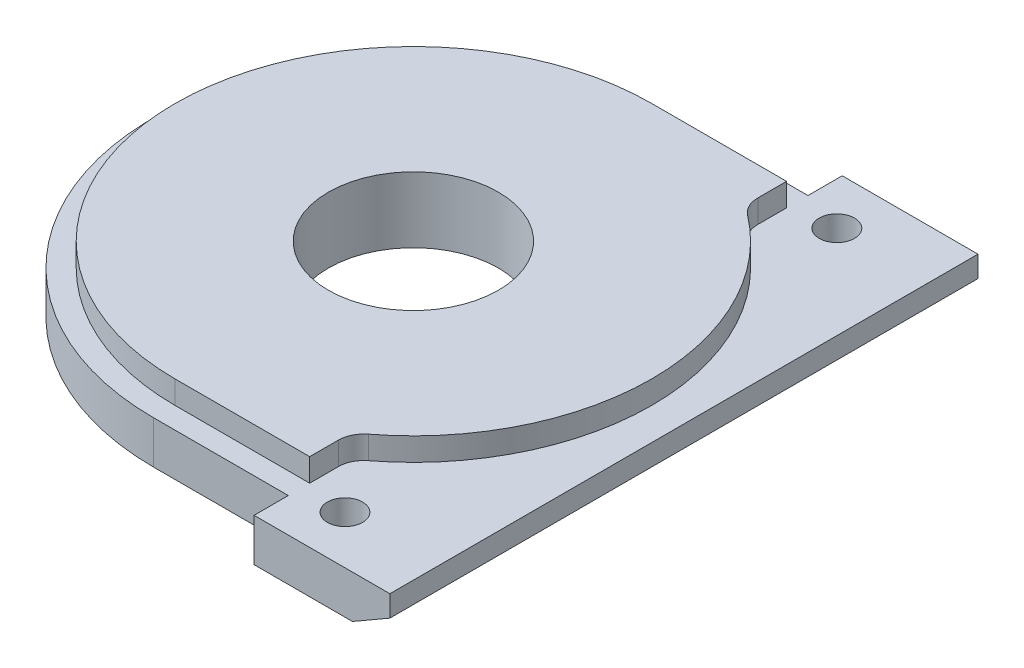
from build123d import *

# Parameters (mm, degrees)
BOSS_EXTRUDE1_DEPTH = 4
BOSS_EXTRUDE2_DEPTH = 2.25
SKETCH3_R           = 7.95
CUT_EXTRUDE1_DEPTH  = 9.25
SKETCH4_R           = 1.65
CUT_EXTRUDE2_DEPTH  = 9.25
CUT_EXTRUDE3_DEPTH  = 3
FILLET1_R           = 2.38125
CHAMFER1_SIZE       = 3.5
CHAMFER1_SIZE2      = 2.020725942
BOSS_EXTRUDE3_DEPTH = 4
SKETCH7_W           = 56.562445917
SKETCH7_H           = 51.963873078
CUT_EXTRUDE4_DEPTH  = 0.1
FILLET3_R           = 2.38


with BuildPart() as part:
    # Sketch1 → Boss-Extrude1 (new body)
    with BuildSketch(Plane(origin=(0, 0, 0), x_dir=(1, 0, 0), z_dir=(0, 1, 0))):
        with BuildLine():
            Line((-13.29118379, 20.889836125), (-0.68999579, 20.889836125))
            Line((-0.68999579, 20.889836125), (-0.68999579, 24.09210312))
            Line((-0.68999579, 24.09210312), (-0.68999579, 26.09210312))
            Line((-0.68999579, 26.09210312), (12.01000421, 26.09210312))
            Line((12.01000421, 26.09210312), (12.01000421, 24.09210312))
            Line((12.01000421, 24.09210312), (12.01000421, -26.90789688))
            Line((12.01000421, -26.90789688), (12.01000421, -28.90789688))
            Line((12.01000421, -28.90789688), (-0.68999579, -28.90789688))
            Line((-0.68999579, -28.90789688), (-0.68999579, -26.90789688))
            Line((-0.68999579, -26.90789688), (-0.68999579, -23.705629885))
            Line((-0.68999579, -23.705629885), (-13.29118379, -23.705629885))
            ThreePointArc((-13.29118379, -23.705629885), (-35.588916795, -1.40789688), (-13.29118379, 20.889836125))
        make_face()
    extrude(amount=BOSS_EXTRUDE1_DEPTH)

    # Sketch2 → Boss-Extrude2 (add)
    with BuildSketch(Plane(origin=(0, 4, 0), x_dir=(1, 0, 0), z_dir=(0, 1, 0))):
        with BuildLine():
            Line((-0.68999579, 20.889836125), (-0.68999579, 16.987726462))
            ThreePointArc((-0.68999579, 16.987726462), (9.006549215, -1.40789688), (-0.68999579, -19.803520222))
            Line((-0.68999579, -19.803520222), (-0.68999579, -23.705629885))
            Line((-0.68999579, -23.705629885), (-13.29118379, -23.705629885))
            ThreePointArc((-13.29118379, -23.705629885), (-35.588916795, -1.40789688), (-13.29118379, 20.889836125))
            Line((-13.29118379, 20.889836125), (-0.68999579, 20.889836125))
        make_face()
    extrude(amount=BOSS_EXTRUDE2_DEPTH)

    # Sketch3 → Cut-Extrude1 (cut)
    with BuildSketch(Plane.XZ):
        with Locations((-13.29118379, 1.40789688)):
            Circle(SKETCH3_R)
    extrude(amount=-CUT_EXTRUDE1_DEPTH, mode=Mode.SUBTRACT)

    # Sketch4 → Cut-Extrude2 (cut)
    with BuildSketch(Plane.XZ):
        with Locations((3.31000421, -21.59210312)):
            Circle(SKETCH4_R)
        with Locations((3.31000421, 24.40789688)):
            Circle(SKETCH4_R)
    extrude(amount=-CUT_EXTRUDE2_DEPTH, mode=Mode.SUBTRACT)

    # Sketch5 → Cut-Extrude3 (cut)
    with BuildSketch(Plane.XZ):
        with BuildLine():
            ThreePointArc((-20.917233099, -7.792422241), (-25.24118379, 1.40789688), (-20.917233099, 10.608216001))
            Line((-20.917233099, 10.608216001), (-24.193916765, 16.291878661))
            ThreePointArc((-24.193916765, 16.291878661), (-31.74118379, 1.40789688), (-24.193916765, -13.476084902))
            Line((-24.193916765, -13.476084902), (-20.917233099, -7.792422241))
        make_face()
        with BuildLine():
            Line((-20.729723635, 18.291931497), (-17.445869217, 12.612408873))
            ThreePointArc((-17.445869217, 12.612408873), (-7.31618379, 11.756900455), (-1.510449053, 3.412089752))
            Line((-1.510449053, 3.412089752), (5.05008903, 3.407949716))
            ThreePointArc((5.05008903, 3.407949716), (-4.06618379, 17.38606558), (-20.729723635, 18.291931497))
        make_face()
        with BuildLine():
            ThreePointArc((-1.510449053, -0.596295992), (-7.31618379, -8.941106696), (-17.445869217, -9.796615113))
            Line((-17.445869217, -9.796615113), (-20.729723635, -15.476137738))
            ThreePointArc((-20.729723635, -15.476137738), (-4.06618379, -14.57027182), (5.05008903, -0.592155956))
            Line((5.05008903, -0.592155956), (-1.510449053, -0.596295992))
        make_face()
    extrude(amount=-CUT_EXTRUDE3_DEPTH, mode=Mode.SUBTRACT)

    # Fillet1
    fillet1_edges = [part.edges().sort_by_distance(p)[0] for p in [
        (5.05008903, 1.5, 3.407949716),
        (-1.510449053, 1.5, 3.412089752),
        (5.05008903, 1.5, -0.592155956),
        (-24.193916765, 1.5, 16.291878661),
        (-20.729723635, 1.5, 18.291931497),
        (-1.510449053, 1.5, -0.596295992),
        (-20.729723635, 1.5, -15.476137738),
        (-20.917233099, 1.5, 10.608216001),
        (-20.917233099, 1.5, -7.792422241),
        (-24.193916765, 1.5, -13.476084902),
        (-17.445869217, 1.5, -9.796615113),
        (-17.445869217, 1.5, 12.612408873),
    ]]
    fillet(fillet1_edges, radius=FILLET1_R)

    # Chamfer1
    chamfer1_edges = [part.edges().sort_by_distance(p)[0] for p in [
        (12.01000421, 0, 1.40789688),
    ]]
    chamfer1_side = [part.faces().sort_by_distance(p)[0] for p in [
        (-3.702499267, 0, 18.015985651),
    ]]
    chamfer(chamfer1_edges, length=CHAMFER1_SIZE, length2=CHAMFER1_SIZE2, reference=chamfer1_side[0])

    # Sketch6 → Boss-Extrude3 (add)
    with BuildSketch(Plane.XZ):
        with BuildLine():
            Line((-0.68999579, -22.889836125), (-13.29118379, -22.889836125))
            ThreePointArc((-13.29118379, -22.889836125), (-37.588916795, 1.40789688), (-13.29118379, 25.705629885))
            Line((-13.29118379, 25.705629885), (-0.68999579, 25.705629885))
            Line((-0.68999579, 25.705629885), (-0.68999579, 23.705629885))
            Line((-0.68999579, 23.705629885), (-13.29118379, 23.705629885))
            ThreePointArc((-13.29118379, 23.705629885), (-35.588916795, 1.40789688), (-13.29118379, -20.889836125))
            Line((-13.29118379, -20.889836125), (-0.68999579, -20.889836125))
            Line((-0.68999579, -20.889836125), (-0.68999579, -22.889836125))
        make_face()
    extrude(amount=-BOSS_EXTRUDE3_DEPTH)

    # Sketch7 → Cut-Extrude4 (cut)
    with BuildSketch(Plane(origin=(0, 6.25, 0), x_dir=(1, 0, 0), z_dir=(0, 1, 0))):
        with Locations((-12.789456293, -2.500057929)):
            Rectangle(SKETCH7_W, SKETCH7_H)
    extrude(amount=-CUT_EXTRUDE4_DEPTH, mode=Mode.SUBTRACT)

    # Fillet3
    fillet3_edges = [part.edges().sort_by_distance(p)[0] for p in [
        (-0.68999579, 5.075, -16.987726462),
        (-0.68999579, 5.075, 19.803520222),
    ]]
    fillet(fillet3_edges, radius=FILLET3_R)


solid = part.part
